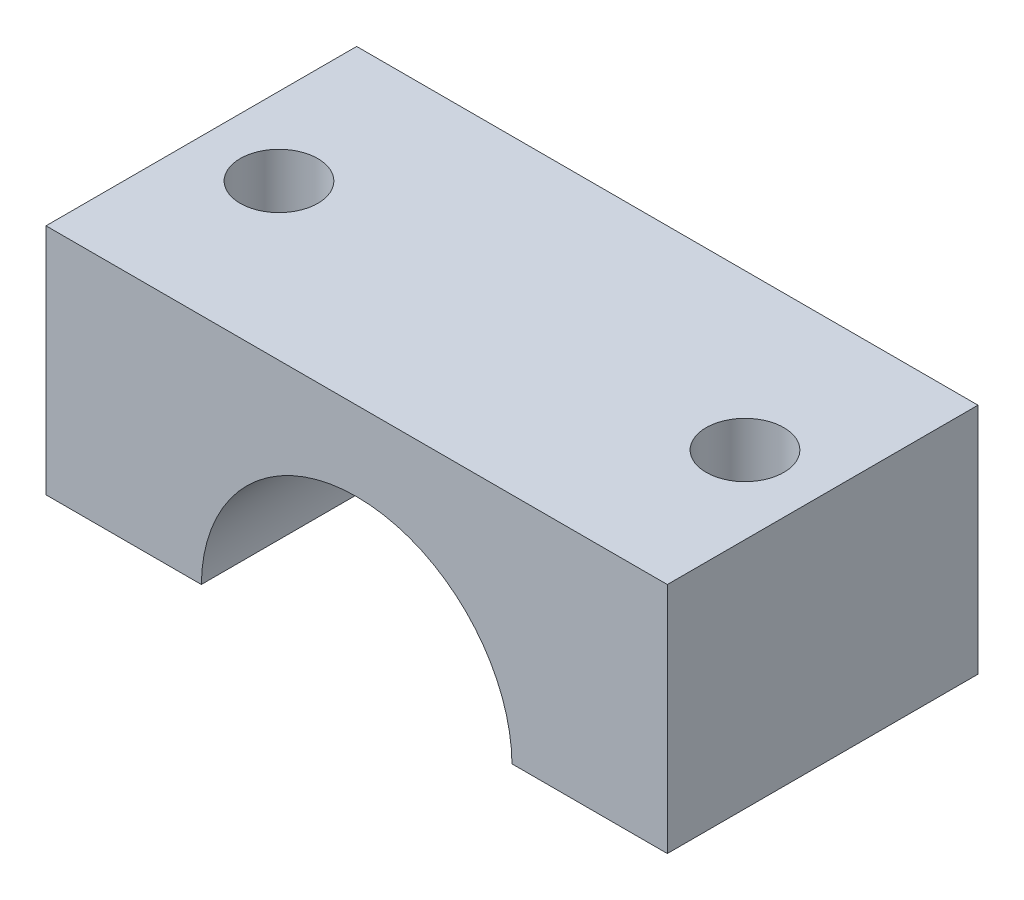
from build123d import *

# Parameters (mm, degrees)
SKETCH1_W        = 50.8
SKETCH1_H        = 25.4
BLOCK_DEPTH      = 19.05
SKETCH2_R        = 12.7
SHAFTHOLE_DEPTH  = 41.659838908
CLAMPING_HOLES_D = 6.35


with BuildPart() as part:
    # Sketch1 → Block (new body)
    with BuildSketch(Plane(origin=(0, 0, 0), x_dir=(1, 0, 0), z_dir=(0, 1, 0))):
        Rectangle(SKETCH1_W, SKETCH1_H)
    extrude(amount=BLOCK_DEPTH)

    # Sketch2 → ShaftHole (cut, through all)
    with BuildSketch(Plane.XY.offset(12.7)):
        with Locations((0, -0.127)):
            Circle(SKETCH2_R)
    extrude(amount=-SHAFTHOLE_DEPTH, mode=Mode.SUBTRACT)

    # Clamping Holes (through all)
    with Locations(Plane(origin=(0, 19.05, 0), x_dir=(1, 0, 0), z_dir=(0, 1, 0))):
        with Locations((-19.05, 0), (19.05, 0)):
            Hole(CLAMPING_HOLES_D / 2)


solid = part.part
